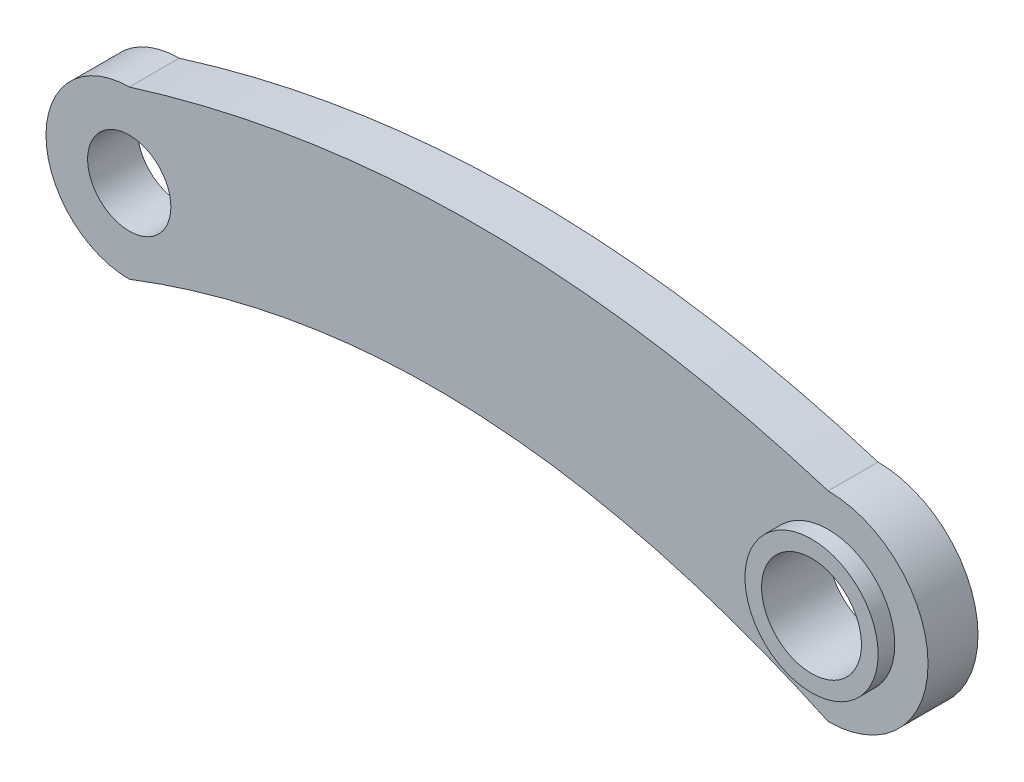
from build123d import *

# Parameters (mm, degrees)
BOSS_EXTRUDE1_DEPTH = 30
SKETCH2_R           = 25
SKETCH2_R_2         = 30
CUT_EXTRUDE1_DEPTH  = 527.798524366
SKETCH4_R           = 40
SKETCH4_R_2         = 30
BOSS_EXTRUDE3_DEPTH = 10
SCALE1_SCALE        = 0.1


with BuildPart() as part:
    # Sketch1 → Boss-Extrude1 (new body)
    with BuildSketch(Plane.XY):
        with BuildLine():
            add(Edge.make_bspline(
                [(-267.733324074, 386.480114093), (-58.376892778, 451.86591416), (152.142574227, 386.270803333)],
                knots=[0, 0, 0, 1, 1, 1], degree=2))
            ThreePointArc((-267.733324074, 386.480114093), (-317.733324074, 336.480114093), (-267.733324074, 286.480114093))
            add(Edge.make_bspline(
                [(-267.733324074, 286.480114093), (-61.536299878, 365.758634067), (152.142574227, 266.270803333)],
                knots=[0, 0, 0, 1, 1, 1], degree=2))
            ThreePointArc((152.142574227, 266.270803333), (212.142574227, 326.270803333), (152.142574227, 386.270803333))
        make_face()
    extrude(amount=BOSS_EXTRUDE1_DEPTH)

    # Sketch2 → Cut-Extrude1 (cut, through all)
    with BuildSketch(Plane.XY):
        with Locations((-267.733324074, 336.480114093)):
            Circle(SKETCH2_R)
        with Locations((152.142574227, 326.270803333)):
            Circle(SKETCH2_R_2)
    extrude(amount=CUT_EXTRUDE1_DEPTH, mode=Mode.SUBTRACT)

    # Sketch4 → Boss-Extrude3 (add)
    with BuildSketch(Plane.XY.offset(30)):
        with Locations((152.142574227, 326.270803333)):
            Circle(SKETCH4_R)
        with Locations((152.142574227, 326.270803333)):
            Circle(SKETCH4_R_2, mode=Mode.SUBTRACT)
    extrude(amount=BOSS_EXTRUDE3_DEPTH)


with BuildPart() as part_1:
    # Scale1: scaled about (-43.370651933, 353.535569424, 15.302961692)
    add(part.part.scale(SCALE1_SCALE).moved(Location((-39.03358674, 318.182012482, 13.772665523))))


solid = part_1.part
